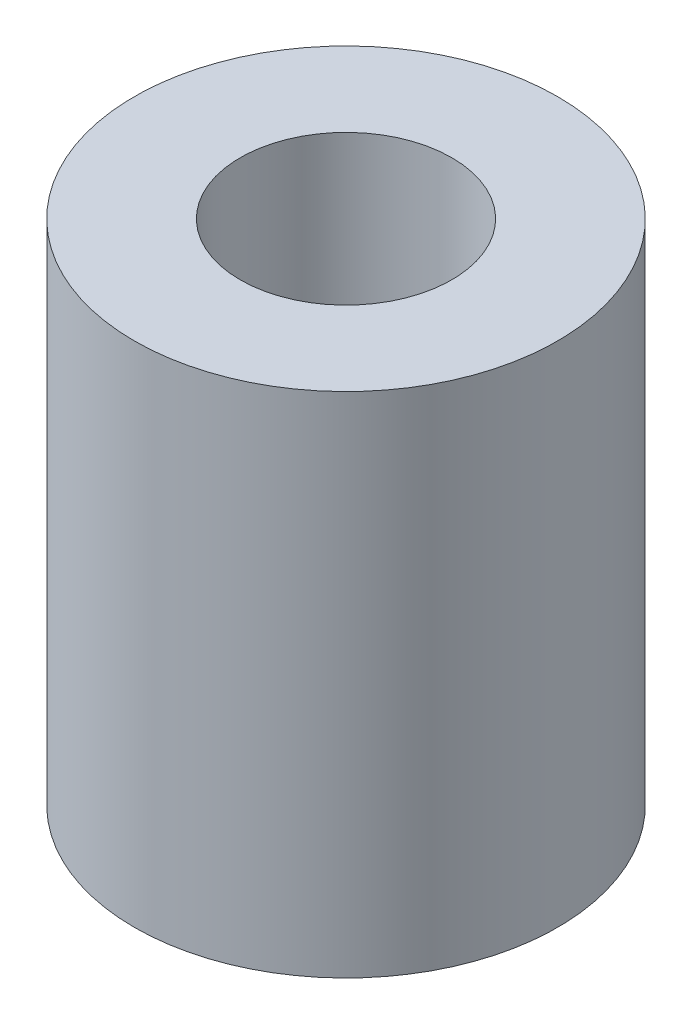
from build123d import *

# Parameters (mm, degrees)
SKETCH1_R             = 2.5
BOSS_EXTRUDE1_DEPTH   = 6
M3X0_5_TAPPED_HOLE1_D = 2.5


with BuildPart() as part:
    # Sketch1 → Boss-Extrude1 (new body)
    with BuildSketch(Plane(origin=(0, 0, 0), x_dir=(1, 0, 0), z_dir=(0, 1, 0))):
        with Locations(Location((0, 0, 0), (0, 0, 270))):
            Circle(SKETCH1_R)
    extrude(amount=BOSS_EXTRUDE1_DEPTH)

    # M3x0.5 Tapped Hole1 (through all)
    with Locations(Plane(origin=(0, 6, 0), x_dir=(1, 0, 0), z_dir=(0, 1, 0))):
        with Locations((0, 0)):
            Hole(M3X0_5_TAPPED_HOLE1_D / 2)


solid = part.part
